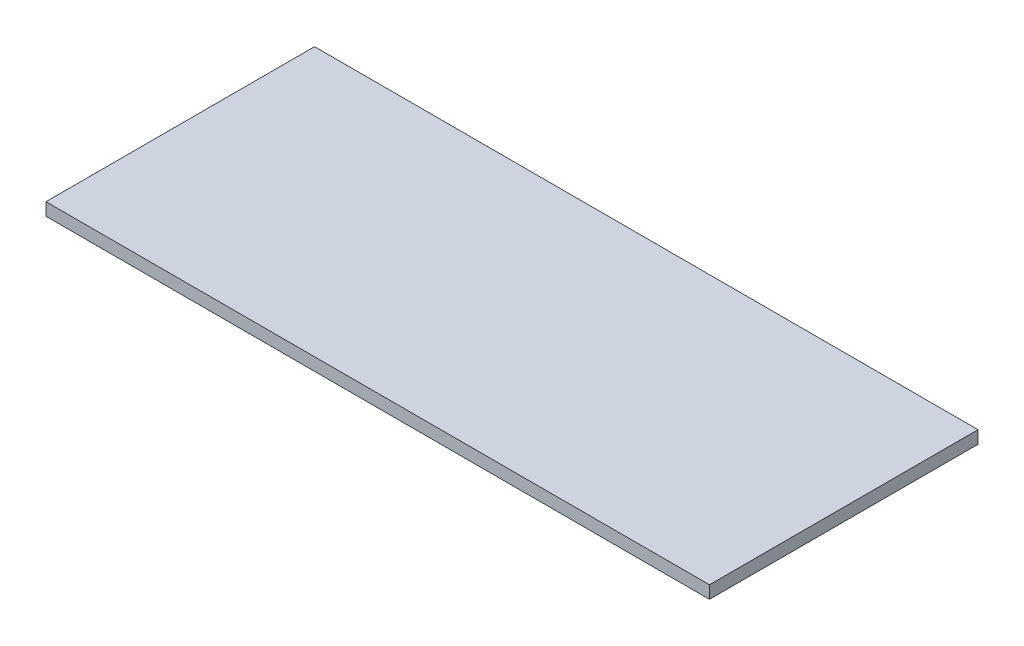
from build123d import *

# Parameters (mm, degrees)
SKETCH1_W           = 2100
SKETCH1_H           = 850
BOSS_EXTRUDE1_DEPTH = 40


with BuildPart() as part:
    # Sketch1 → Boss-Extrude1 (new body)
    with BuildSketch(Plane(origin=(0, 0, 0), x_dir=(1, 0, 0), z_dir=(0, 1, 0))):
        Rectangle(SKETCH1_W, SKETCH1_H)
    extrude(amount=BOSS_EXTRUDE1_DEPTH)


solid = part.part
